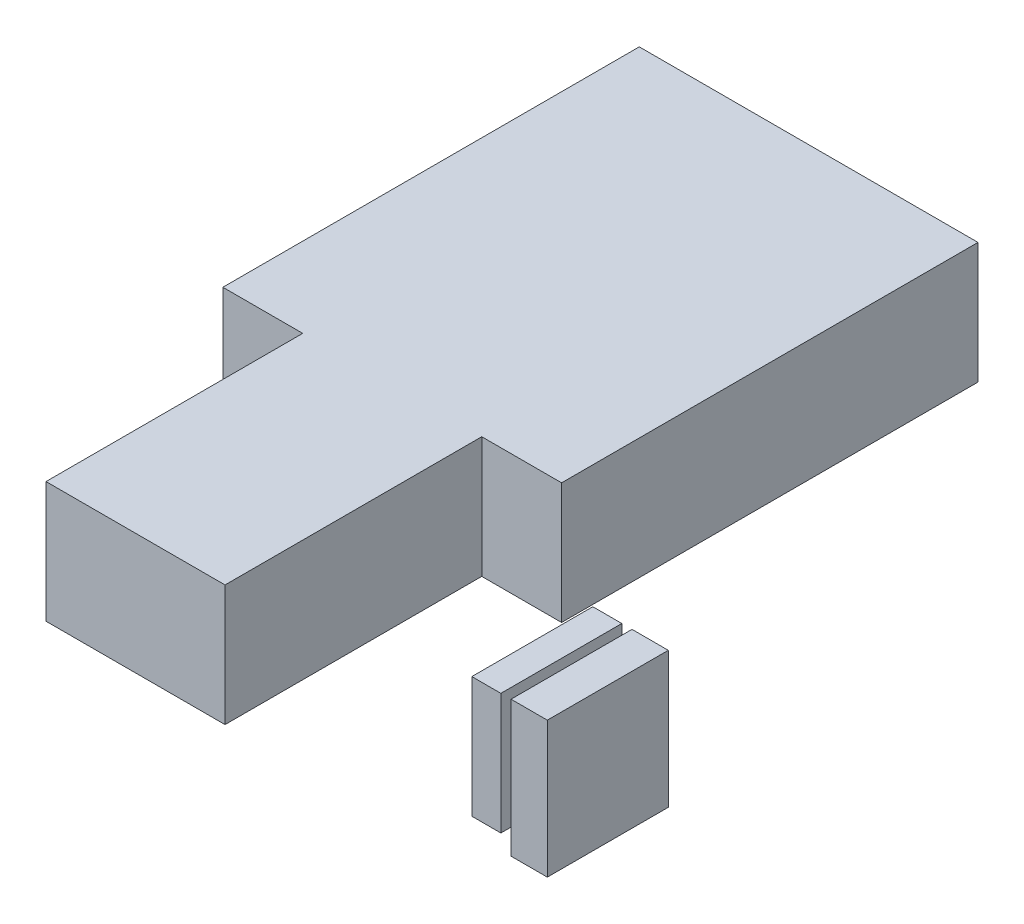
from build123d import *

# Parameters (mm, degrees)
SKETCH1_W           = 25
SKETCH1_H           = 25
BOSS_EXTRUDE1_DEPTH = 6
SKETCH3_W           = 25
SKETCH3_H           = 28.1
BOSS_EXTRUDE2_DEPTH = 7.5
BOSS_EXTRUDE3_DEPTH = 25


with BuildPart() as part:
    # Sketch1 → Boss-Extrude1 (new body)
    with BuildSketch(Plane(origin=(0, 0, 0), x_dir=(0, 0, -1), z_dir=(1, 0, 0))):
        Rectangle(SKETCH1_W, SKETCH1_H)
    extrude(amount=BOSS_EXTRUDE1_DEPTH)


with BuildPart() as body_2:
    # Sketch3 → Boss-Extrude2 (new body)
    with BuildSketch(Plane.ZY.offset(-15.6)):
        with Locations((0, -1.55)):
            Rectangle(SKETCH3_W, SKETCH3_H)
    extrude(amount=BOSS_EXTRUDE2_DEPTH)


with BuildPart() as body_3:
    # Sketch12 → Boss-Extrude3 (new body)
    with BuildSketch(Plane(origin=(0, -15.6, 0), x_dir=(1, 0, 0), z_dir=(0, 1, 0))):
        Polygon((-98.5, 120.6), (-28.5, 120.6), (-28.5, 34.55), (-45, 34.55), (-45, -18.5), (-82, -18.5), (-82, 34.55), (-98.5, 34.55), align=None)
    extrude(amount=BOSS_EXTRUDE3_DEPTH)


solid = Compound([part.part, body_2.part, body_3.part])
